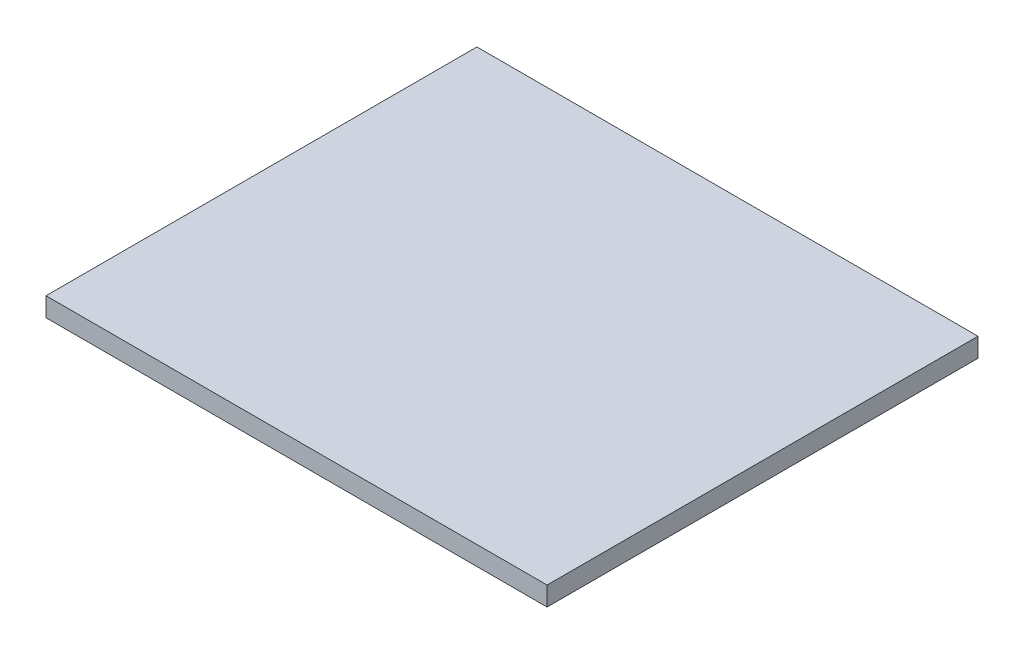
from build123d import *

# Parameters (mm, degrees)
SKETCH1_W           = 500
SKETCH1_H           = 430
BOSS_EXTRUDE1_DEPTH = 19.05


with BuildPart() as part:
    # Sketch1 → Boss-Extrude1 (new body)
    with BuildSketch(Plane(origin=(0, 0, 0), x_dir=(1, 0, 0), z_dir=(0, 1, 0))):
        Rectangle(SKETCH1_W, SKETCH1_H)
    extrude(amount=BOSS_EXTRUDE1_DEPTH)


solid = part.part
